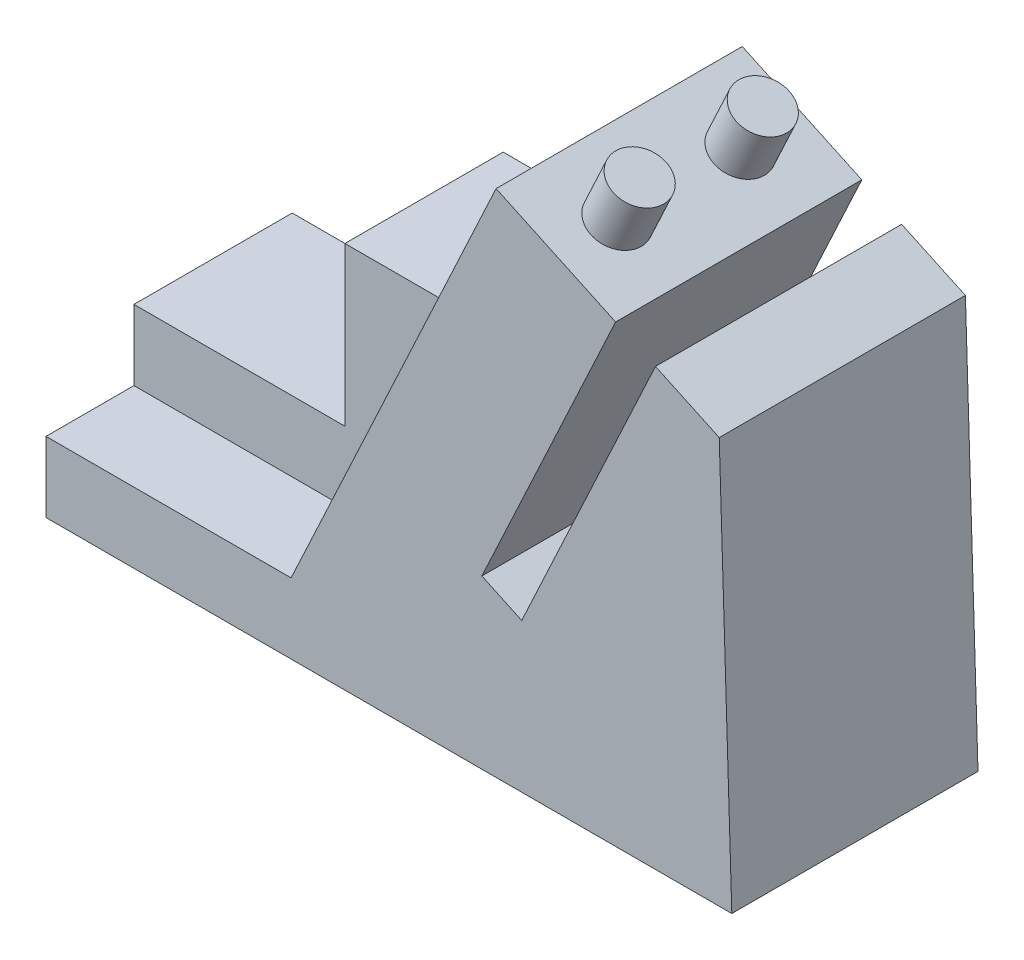
from build123d import *

# Parameters (mm, degrees)
BOSS_EXTRUDE1_DEPTH = 28
BOSS_EXTRUDE2_DEPTH = 18
SKETCH2_R           = 3
BOSS_EXTRUDE3_DEPTH = 6


with BuildPart() as part:
    # Sketch1 → Boss-Extrude1 (new body)
    with BuildSketch(Plane.XY):
        Polygon((0, 0), (78, 0), (76.568001833, 46.166688671), (69.317539536, 49.547634765), (54.103282114, 16.920554432), (49.571743179, 19.033645741), (64.786000601, 51.660726074), (51.191383796, 58), (27.876000888, 8), (0, 8), align=None)
    extrude(amount=BOSS_EXTRUDE1_DEPTH)

    # Sketch1<3> → Boss-Extrude2 (add)
    with BuildSketch(Plane.XY):
        Polygon((0, 16), (0, 8), (27.876000888, 8), (40, 34), (24, 34), (24, 16), align=None)
    extrude(amount=BOSS_EXTRUDE2_DEPTH)

    # Sketch2 → Boss-Extrude3 (add)
    with BuildSketch(Plane(origin=(31.358387135, 67.248278227, 0), x_dir=(0.9063077870366482, -0.4226182617407034, 0), z_dir=(0.4226182617407034, 0.9063077870366482, 0))):
        with Locations((29.383290582, -7)):
            Circle(SKETCH2_R)
        with Locations((29.383290582, -21)):
            Circle(SKETCH2_R)
    extrude(amount=BOSS_EXTRUDE3_DEPTH)


solid = part.part
